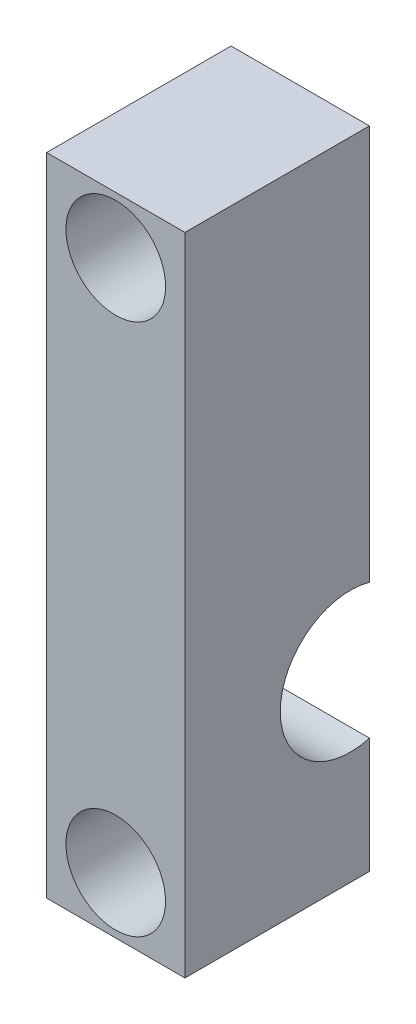
from build123d import *

# Parameters (mm, degrees)
SKETCH1_W           = 9.525
SKETCH1_H           = 44.45
BOSS_EXTRUDE1_DEPTH = 12.7
SKETCH2_R           = 3.429
CUT_EXTRUDE1_DEPTH  = 6.35
SKETCH3_R           = 1.397
CUT_EXTRUDE2_DEPTH  = 33.348528515
SKETCH4_R           = 4.826
SKETCH4_R_2         = 4.7625
CUT_EXTRUDE3_DEPTH  = 35.841784793


with BuildPart() as part:
    # Sketch1 → Boss-Extrude1 (new body)
    with BuildSketch(Plane.XY):
        with Locations((-1.883585653, 8.79006638)):
            Rectangle(SKETCH1_W, SKETCH1_H)
    extrude(amount=BOSS_EXTRUDE1_DEPTH)

    # Sketch2 → Cut-Extrude1 (cut)
    with BuildSketch(Plane.XY.offset(12.7)):
        with Locations((-1.883585653, 27.11616638)):
            Circle(SKETCH2_R)
        with Locations((-1.883585653, -9.53603362)):
            Circle(SKETCH2_R)
    extrude(amount=-CUT_EXTRUDE1_DEPTH, mode=Mode.SUBTRACT)

    # Sketch3 → Cut-Extrude2 (cut, through all)
    with BuildSketch(Plane.XY.offset(6.35)):
        with Locations((-1.883585653, 27.11616638)):
            Circle(SKETCH3_R)
        with Locations((-1.883585653, -9.53603362)):
            Circle(SKETCH3_R)
    extrude(amount=-CUT_EXTRUDE2_DEPTH, mode=Mode.SUBTRACT)

    # Sketch4 → Cut-Extrude3 (cut, through all)
    with BuildSketch(Plane.ZY.offset(6.646085653)):
        with Locations((1.312301335, -0.841200319)):
            Circle(SKETCH4_R)
        with Locations((1.312301335, -0.841200319)):
            Circle(SKETCH4_R_2, mode=Mode.SUBTRACT)
    extrude(amount=-CUT_EXTRUDE3_DEPTH, mode=Mode.SUBTRACT)


with BuildPart() as cut_extrude3_kept_piece:
    # of the separate pieces the step leaves, the one the design keeps (cut_extrude3_pieces_kept)
    add(part.part.solids().sort_by_distance((-6.646085653, 31.01506638, 0))[0])


solid = cut_extrude3_kept_piece.part
